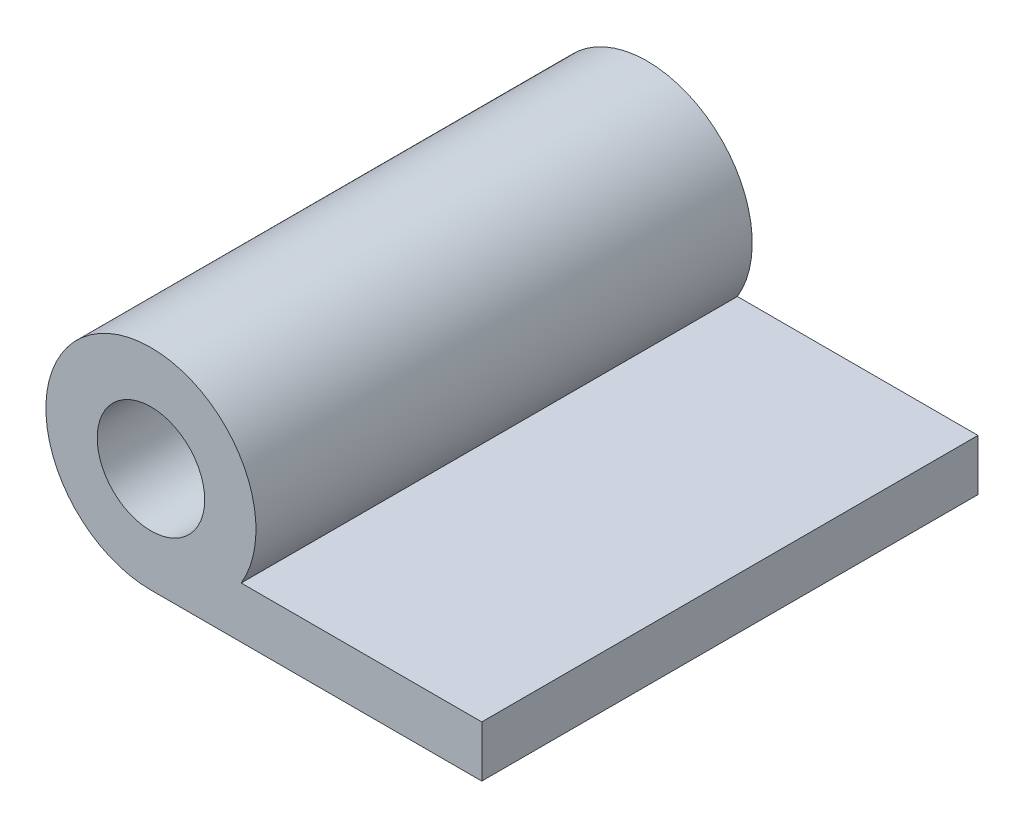
from build123d import *

# Parameters (mm, degrees)
ESBO_O1_R                = 6.35
ESBO_O1_R_2              = 3.25
RESSALTO_EXTRUS_O1_DEPTH = 15
ESBO_O2_W                = 20
ESBO_O2_H                = 3.1
RESSALTO_EXTRUS_O2_DEPTH = 30


with BuildPart() as part:
    # Esboço1 → Ressalto-extrusão1 (new, symmetric)
    with BuildSketch(Plane.XY):
        Circle(ESBO_O1_R)
        Circle(ESBO_O1_R_2, mode=Mode.SUBTRACT)
    extrude(amount=RESSALTO_EXTRUS_O1_DEPTH, both=True)

    # Esboço2 → Ressalto-extrusão2 (add)
    with BuildSketch(Plane.XY.offset(15)):
        with Locations((10, -4.8)):
            Rectangle(ESBO_O2_W, ESBO_O2_H)
    extrude(amount=-RESSALTO_EXTRUS_O2_DEPTH)


solid = part.part
